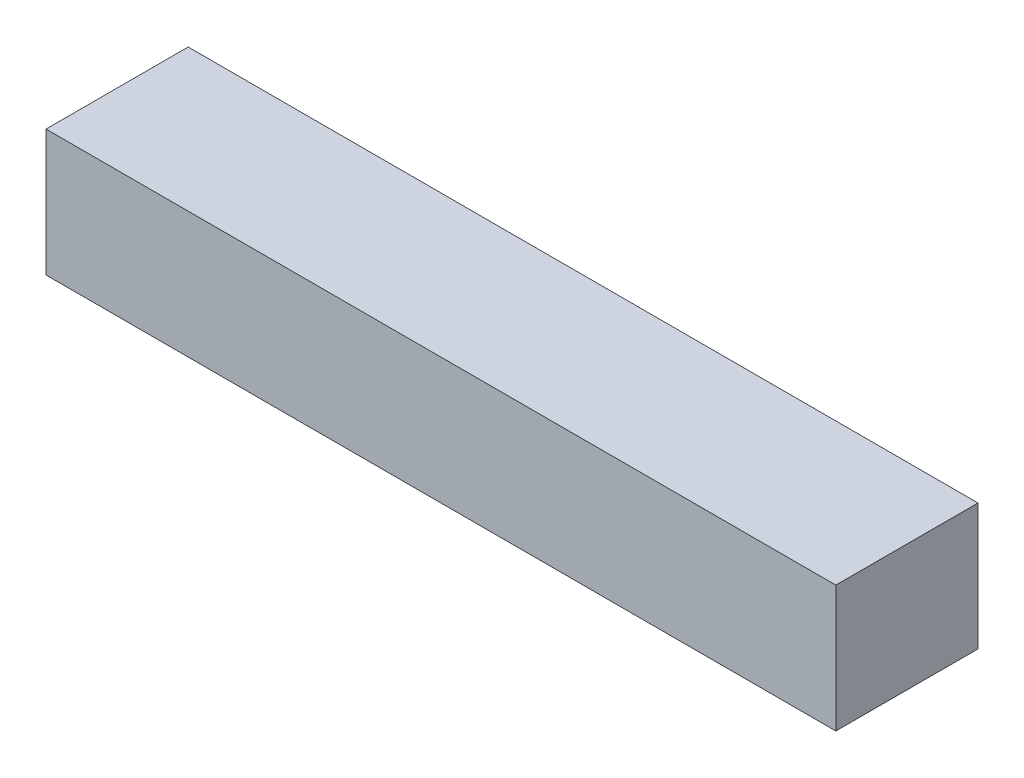
from build123d import *

# Parameters (mm, degrees)
CROSSHEAD_START = 54
SKETCH1_W       = 4.5
SKETCH1_H       = 4
CROSSHEAD_DEPTH = 25
ROD_SLOT_START  = 63.24
SKETCH2_W       = 2.2
SKETCH2_H       = 1.6
ROD_SLOT_DEPTH  = 6.2


with BuildPart() as part:
    # Sketch1 → crosshead (new body)
    with BuildSketch(Plane(origin=(0, 0, 0), x_dir=(0, 0, -1), z_dir=(1, 0, 0)).offset(CROSSHEAD_START)):
        with Locations((-36.75, 178)):
            Rectangle(SKETCH1_W, SKETCH1_H)
    extrude(amount=CROSSHEAD_DEPTH)


with BuildPart() as body_2:
    # Sketch2 → rod_slot (new body)
    with BuildSketch(Plane(origin=(0, 0, 0), x_dir=(0, 0, -1), z_dir=(1, 0, 0)).offset(ROD_SLOT_START)):
        with Locations((-36.5, 176.7)):
            Rectangle(SKETCH2_W, SKETCH2_H)
    extrude(amount=ROD_SLOT_DEPTH)


with BuildPart() as part_1:
    add(part.part)

    # Combine1: cut body 2
    add(body_2.part, mode=Mode.SUBTRACT)


solid = part_1.part
